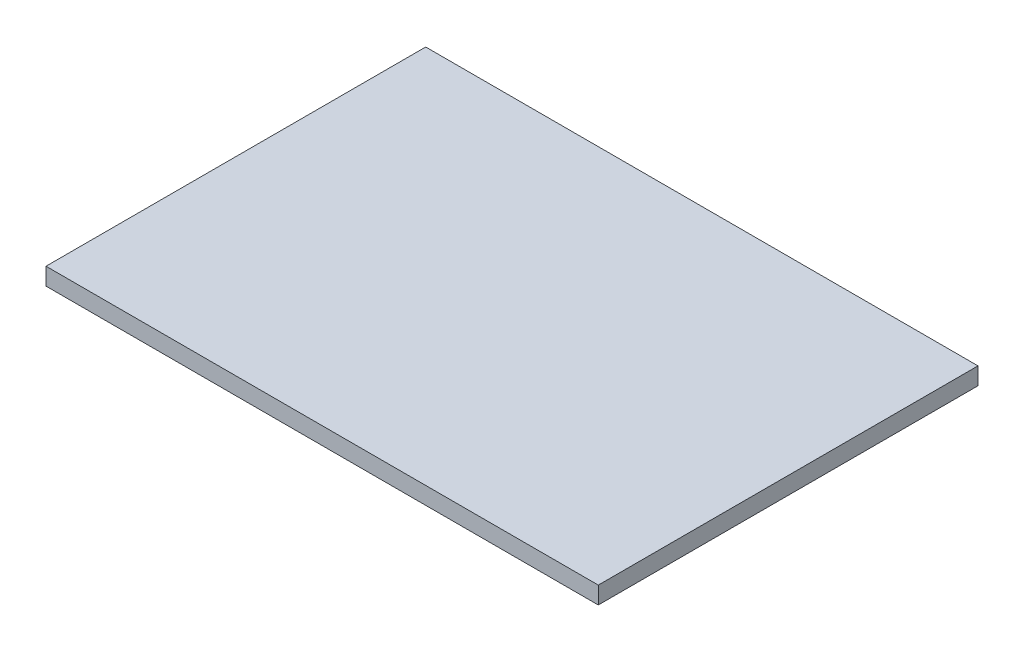
from build123d import *

# Parameters (mm, degrees)
SKETCH1_W           = 812.8
SKETCH1_H           = 558.8
BOSS_EXTRUDE1_DEPTH = 25.4


with BuildPart() as part:
    # Sketch1 → Boss-Extrude1 (new body)
    with BuildSketch(Plane(origin=(0, 0, 0), x_dir=(1, 0, 0), z_dir=(0, 1, 0))):
        with Locations((-279.4, -38.1)):
            Rectangle(SKETCH1_W, SKETCH1_H)
    extrude(amount=BOSS_EXTRUDE1_DEPTH)


solid = part.part
